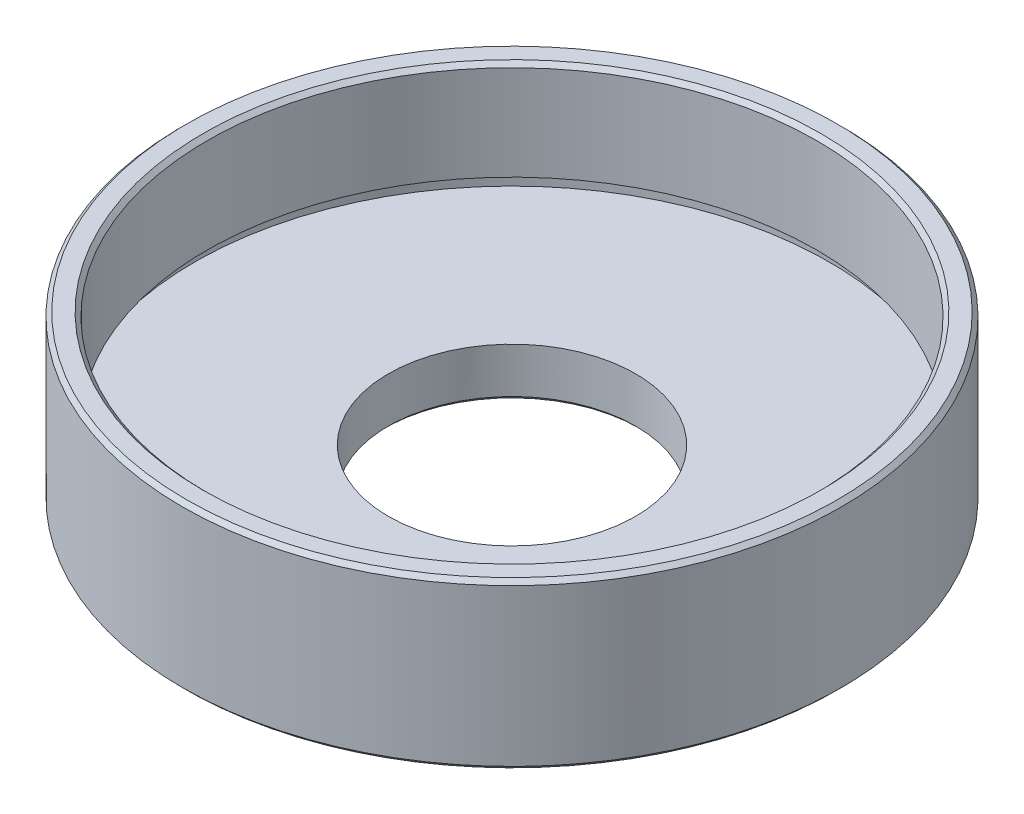
from build123d import *

# Parameters (mm, degrees)
CHAMFER_1_SIZE = 0.5


with BuildPart() as part:
    # Эскиз1 → Повернуть1 (revolve)
    with BuildSketch(Plane.XY):
        Polygon((-40, 20), (-40, 0), (-15, 0), (-15, 6), (-38.5, 6), (-38.5, 8), (-37, 8), (-37, 20), align=None)
    revolve(axis=Axis((0, 26.168985987, 0), (0, -1, 0)))

    # Фаска1
    chamfer_1_edges = [part.edges().sort_by_distance(p)[0] for p in [
        (15, 0, 0),
        (40, 0, 0),
        (40, 20, 0),
        (37, 20, 0),
    ]]
    chamfer(chamfer_1_edges, length=CHAMFER_1_SIZE)


solid = part.part
